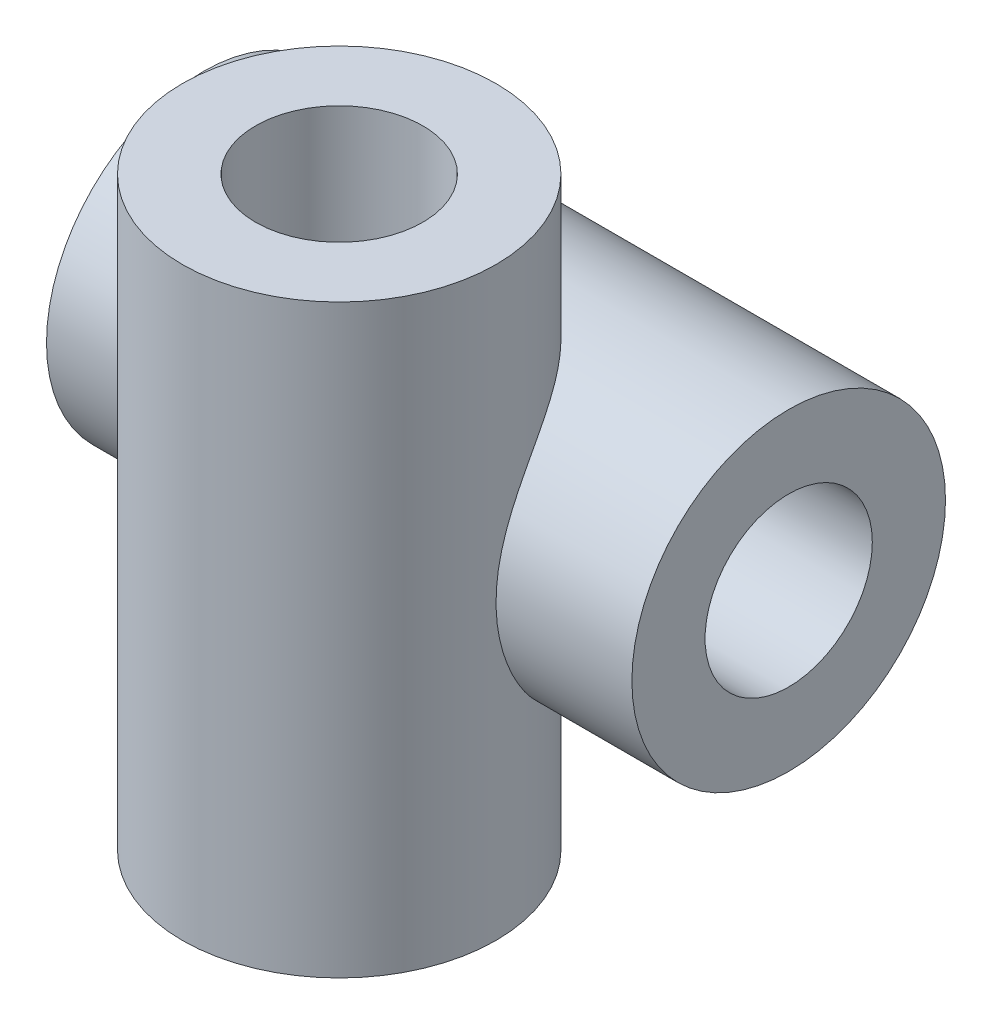
from build123d import *

# Parameters (mm, degrees)
SKETCH1_R           = 15
SKETCH1_R_2         = 8
BOSS_EXTRUDE1_DEPTH = 28
SKETCH2_R           = 15
SKETCH2_R_2         = 8
BOSS_EXTRUDE2_DEPTH = 28
SKETCH3_R           = 8
CUT_EXTRUDE1_DEPTH  = 70.426219995
SKETCH4_R           = 8
CUT_EXTRUDE2_DEPTH  = 70.426219995


with BuildPart() as part:
    # Sketch1 → Boss-Extrude1 (new, symmetric)
    with BuildSketch(Plane(origin=(0, 0, 0), x_dir=(1, 0, 0), z_dir=(0, 1, 0))):
        with Locations(Location((0, 0, 0), (0, 0, 270))):
            Circle(SKETCH1_R)
        with Locations(Location((0, 0, 0), (0, 0, 270))):
            Circle(SKETCH1_R_2, mode=Mode.SUBTRACT)
    extrude(amount=BOSS_EXTRUDE1_DEPTH, both=True)

    # Sketch2 → Boss-Extrude2 (add, symmetric)
    with BuildSketch(Plane(origin=(0, 0, 0), x_dir=(0, 0, -1), z_dir=(1, 0, 0))):
        with Locations((15, 0)):
            Circle(SKETCH2_R)
        with Locations((15, 0)):
            Circle(SKETCH2_R_2, mode=Mode.SUBTRACT)
    extrude(amount=BOSS_EXTRUDE2_DEPTH, both=True)

    # Sketch3 → Cut-Extrude1 (cut, through all)
    with BuildSketch(Plane(origin=(0, 28, 0), x_dir=(1, 0, 0), z_dir=(0, 1, 0))):
        with Locations(Location((0, 0, 0), (0, 0, 270))):
            Circle(SKETCH3_R)
    extrude(amount=-CUT_EXTRUDE1_DEPTH, mode=Mode.SUBTRACT)

    # Sketch4 → Cut-Extrude2 (cut, through all)
    with BuildSketch(Plane(origin=(28, 0, 0), x_dir=(0, 0, -1), z_dir=(1, 0, 0))):
        with Locations((15, 0)):
            Circle(SKETCH4_R)
    extrude(amount=-CUT_EXTRUDE2_DEPTH, mode=Mode.SUBTRACT)


solid = part.part
